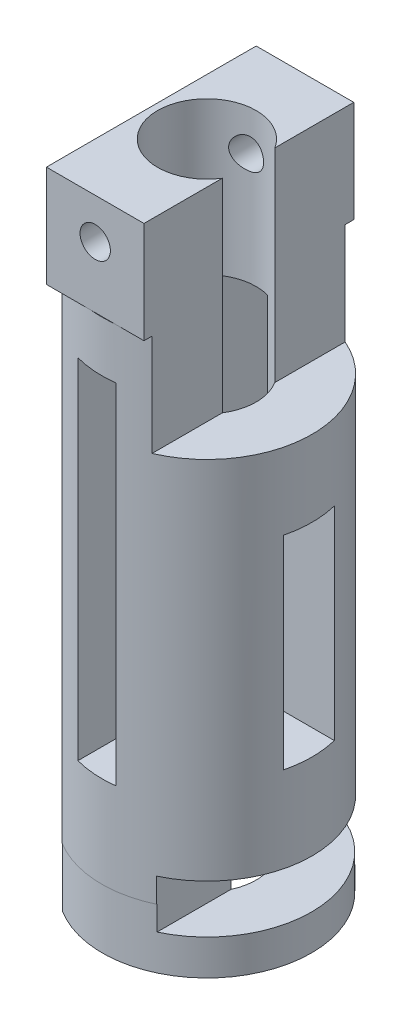
from build123d import *
from build123d.topology import SkipClean

# Parameters (mm, degrees)
SKETCH_1_R           = 20.7
SKETCH_1_R_2         = 9.7
EXTRUDE_1_DEPTH      = 116.68
SKETCH_11_W          = 27
SKETCH_11_H          = 150
CUT_EXTRUDE_3_DEPTH  = 40
SKETCH_13_W          = 10
SKETCH_13_H          = 128.345013401
CUT_EXTRUDE_7_DEPTH  = 126.624847861
SKETCH_15_W          = 8
SKETCH_15_H          = 68.68
CUT_EXTRUDE_9_DEPTH  = 48
SKETCH_16_W          = 15.531795971
SKETCH_16_H          = 20
SKETCH_16_W_2        = 15.421795971
EXTRUDE_4_DEPTH      = 19.2
SKETCH_21_R          = 2.985
CUT_EXTRUDE_12_DEPTH = 55.2
SKETCH_24_R          = 20.59
SKETCH_24_R_2        = 9.59
EXTRUDE_2_DEPTH      = 55.2
CUT_EXTRUDE_13_DEPTH = 55.2
SKETCH_26_W          = 10.00851187
SKETCH_26_H          = 41.7
CUT_EXTRUDE_15_DEPTH = 55.2
SKETCH_27_W          = 10
SKETCH_27_H          = 40
CUT_EXTRUDE_16_DEPTH = 55.2
SKETCH_28_W          = 44.880694938
SKETCH_28_H          = 9.608044066
CUT_EXTRUDE_17_DEPTH = 12.2
CUT_EXTRUDE_START    = -130
SKETCH_63_R          = 9.59
CUT_EXTRUDE_36_DEPTH = 130
SKETCH_64_R          = 9.7
CUT_EXTRUDE_37_DEPTH = 132.758249301
SKETCH_66_W          = 4.319030686
SKETCH_66_H          = 0.800519568
CUT_EXTRUDE_39_DEPTH = 20


with BuildPart() as part:
    # 草圖1 → 伸長-薄件1 (new body)
    with BuildSketch(Plane(origin=(0, 0, 0), x_dir=(1, 0, 0), z_dir=(0, 1, 0))):
        Circle(SKETCH_1_R)
        Circle(SKETCH_1_R_2, mode=Mode.SUBTRACT)
    extrude(amount=EXTRUDE_1_DEPTH)

    # 草圖11 → 除料-伸長3 (cut)
    with BuildSketch(Plane(origin=(0, 116.68, 0), x_dir=(1, 0, 0), z_dir=(0, 1, 0))):
        with Locations((21.70851187, -44.235815192)):
            Rectangle(SKETCH_11_W, SKETCH_11_H)
    extrude(amount=-CUT_EXTRUDE_3_DEPTH, mode=Mode.SUBTRACT)

    # 草圖13 → 除料-伸長7 (cut, through all)
    with BuildSketch(Plane.XY.offset(21)):
        with Locations((-16, 58.612182466)):
            Rectangle(SKETCH_13_W, SKETCH_13_H)
    extrude(amount=-CUT_EXTRUDE_7_DEPTH, mode=Mode.SUBTRACT)

    # 草圖15 → 除料-伸長9 (cut)
    with BuildSketch(Plane.XY.offset(21)):
        with Locations((-1.395744065, 52.34)):
            Rectangle(SKETCH_15_W, SKETCH_15_H)
    extrude(amount=-CUT_EXTRUDE_9_DEPTH, mode=Mode.SUBTRACT)

    # 草圖16 → 填料-伸長4 (add)
    with BuildSketch(Plane(origin=(8.20851187, 0, 0), x_dir=(0, 0, -1), z_dir=(1, 0, 0))):
        with Locations((12.934102015, 106.68)):
            Rectangle(SKETCH_16_W, SKETCH_16_H)
        with Locations((-12.879102014, 106.68)):
            Rectangle(SKETCH_16_W_2, SKETCH_16_H)
    extrude(amount=-EXTRUDE_4_DEPTH)

    # 草圖21 → 除料-伸長12 (cut)
    with BuildSketch(Plane(origin=(0, 0, -20.7), x_dir=(-1, 0, 0), z_dir=(0, 0, -1))):
        with Locations((1.39148813, 108.73)):
            Circle(SKETCH_21_R)
    extrude(amount=-CUT_EXTRUDE_12_DEPTH, mode=Mode.SUBTRACT)

    # 草圖24 → 伸長-薄件2 (add)
    with BuildSketch(Plane.XZ):
        Circle(SKETCH_24_R)
        Circle(SKETCH_24_R_2, mode=Mode.SUBTRACT)
    extrude(amount=EXTRUDE_2_DEPTH)

    # 草圖25 → 除料-伸長13 (cut)
    with BuildSketch(Plane.XY.offset(21)):
        Polygon((-1.39148813, -11.785), (22.612379708, -11.785), (22.612379708, -63.873337429), (-22.749525245, -63.873337429), (-22.749525245, -11.785), align=None)
    extrude(amount=-CUT_EXTRUDE_13_DEPTH, mode=Mode.SUBTRACT)

    # 草圖26 → 除料-伸長15 (cut)
    with BuildSketch(Plane(origin=(0, 0, 0), x_dir=(1, 0, 0), z_dir=(0, 1, 0))):
        with Locations((-15.995744065, -0.15)):
            Rectangle(SKETCH_26_W, SKETCH_26_H)
    extrude(amount=-CUT_EXTRUDE_15_DEPTH, mode=Mode.SUBTRACT)

    # 草圖27 → 除料-伸長16 (cut)
    with BuildSketch(Plane(origin=(21, 0, 0), x_dir=(0, 0, -1), z_dir=(1, 0, 0))):
        with Locations((0, 41.68)):
            Rectangle(SKETCH_27_W, SKETCH_27_H)
    extrude(amount=-CUT_EXTRUDE_16_DEPTH, mode=Mode.SUBTRACT)

    # 草圖28 → 除料-伸長17 (cut)
    with BuildSketch(Plane(origin=(21, 0, 0), x_dir=(0, 0, -1), z_dir=(1, 0, 0))):
        Rectangle(SKETCH_28_W, SKETCH_28_H)
    extrude(amount=-CUT_EXTRUDE_17_DEPTH, mode=Mode.SUBTRACT)

    # 草圖63 → 除料-伸長36 (cut)
    with BuildSketch(Plane.XZ.offset(11.785).offset(CUT_EXTRUDE_START)):
        with Locations(Location((0, 0, 0), (0, 0, 90))):
            Circle(SKETCH_63_R)
    extrude(amount=CUT_EXTRUDE_36_DEPTH, mode=Mode.SUBTRACT)

    # 草圖64 → 除料-伸長37 (cut, through all)
    with SkipClean():  # the faces are left unmerged after this step: merging them gives an invalid solid
        with BuildSketch(Plane.XZ.offset(11.785)):
            with Locations(Location((0, 0, 0), (0, 0, 270))):
                Circle(SKETCH_64_R)
        extrude(amount=-CUT_EXTRUDE_37_DEPTH, mode=Mode.SUBTRACT)

    # 草圖66 → 除料-伸長39 (cut)
    with SkipClean():  # the faces are left unmerged after this step: merging them gives an invalid solid
        with BuildSketch(Plane(origin=(0, 116.68, 0), x_dir=(1, 0, 0), z_dir=(0, 1, 0))):
            with Locations((-0.028341957, -20.990259784)):
                Rectangle(SKETCH_66_W, SKETCH_66_H)
        extrude(amount=-CUT_EXTRUDE_39_DEPTH, mode=Mode.SUBTRACT)


solid = part.part
